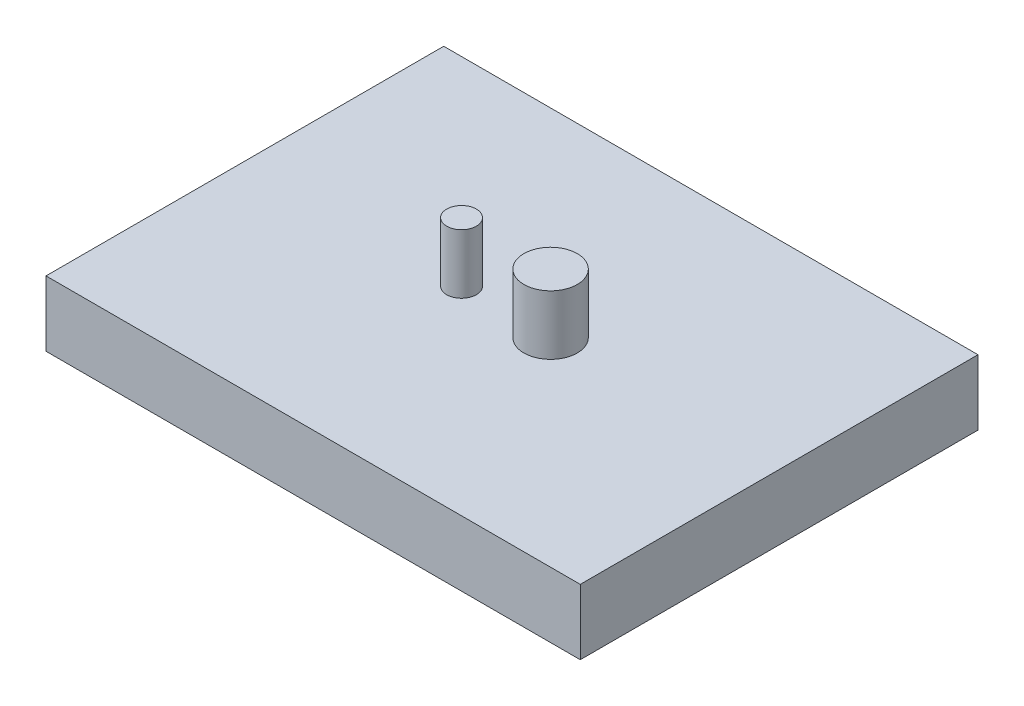
from build123d import *

# Parameters (mm, degrees)
SKETCH_1_W      = 90
SKETCH_1_H      = 67
EXTRUDE_1_DEPTH = 11
SKETCH_2_R      = 2.5
SKETCH_2_R_2    = 4.5
EXTRUDE_2_DEPTH = 10


with BuildPart() as part:
    # Эскиз1 → Бобышка-Вытянуть1 (new body)
    with BuildSketch(Plane(origin=(0, 0, 0), x_dir=(1, 0, 0), z_dir=(0, 1, 0))):
        with Locations((45, -33.5)):
            Rectangle(SKETCH_1_W, SKETCH_1_H)
    extrude(amount=EXTRUDE_1_DEPTH)

    # Эскиз2 → Бобышка-Вытянуть2 (add)
    with BuildSketch(Plane(origin=(0, 11, 0), x_dir=(1, 0, 0), z_dir=(0, 1, 0))):
        with Locations(Location((36.5, -33.5, 0), (0, 0, 270))):
            Circle(SKETCH_2_R)
        with Locations(Location((51.5, -33.5, 0), (0, 0, 270))):
            Circle(SKETCH_2_R_2)
    extrude(amount=EXTRUDE_2_DEPTH)


solid = part.part
